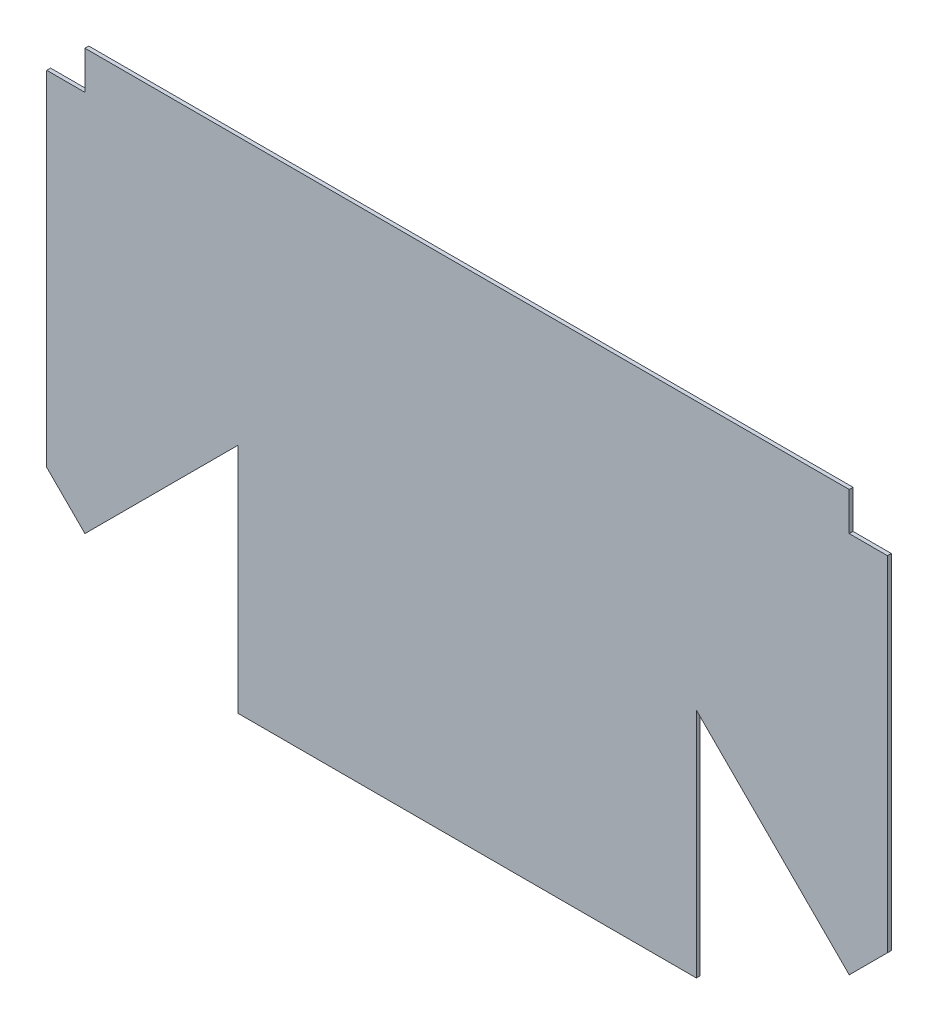
from build123d import *

# Parameters (mm, degrees)
SALIENTE_EXTRUIR1_DEPTH = 1


with BuildPart() as part:
    # Croquis1 → Saliente-Extruir1 (new body)
    with BuildSketch(Plane.XY):
        Polygon((0, 0), (-10, 0), (-10, 10), (-210, 10), (-210, 0), (-220, 0), (-220, -90), (-210, -100), (-170, -60), (-170, -120.710678119), (-50, -120.710678119), (-50, -60), (-10, -100), (0, -90), align=None)
    extrude(amount=SALIENTE_EXTRUIR1_DEPTH)


solid = part.part
